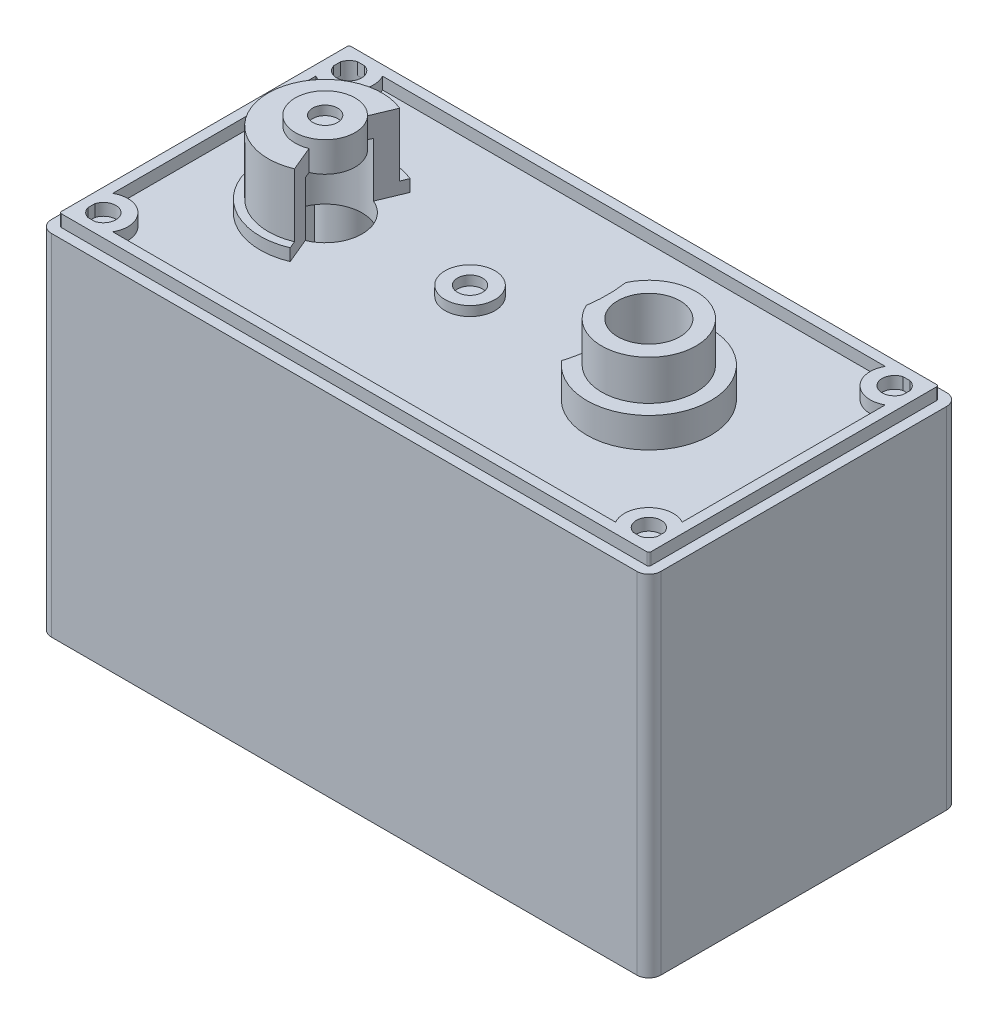
from build123d import *

# Parameters (mm, degrees)
SKETCH1_R                       = 2.3495
SKETCH1_R_2                     = 1.9812
EXTRUDE1_DEPTH                  = 1.190625
SKETCH6_R                       = 1.5875
SKETCH6_R_2                     = 0.79375
EXTRUDE3_DEPTH                  = 0.6096
SKETCH7_R                       = 3
SKETCH7_R_2                     = 1.9812
EXTRUDE4_DEPTH                  = 4.445
SKETCH16_R                      = 3.937
SKETCH16_R_2                    = 3
EXTRUDE11_DEPTH                 = 1.905
CUT_EXTRUDE1_REACH              = 24.444
SKETCH11_R                      = 7.874
SKETCH11_R_2                    = 6.604
EXTRUDE6_DEPTH                  = 4.572
EXTRUDE5_START                  = 22.225
SKETCH10_W                      = 37.211
SKETCH10_H                      = 18.161
EXTRUDE5_DEPTH                  = 22.225
SKETCH13_W                      = 1.143
SKETCH13_H                      = 3.048
EXTRUDE8_DEPTH                  = 10.795
EXTRUDE9_START                  = -1.952625
SKETCH14_R                      = 0.79375
EXTRUDE9_DEPTH                  = 22.987
SKETCH23_R                      = 0.79375
CUT_EXTRUDE2_DEPTH              = 1.190625
CUT_EXTRUDE3_REACH              = 36.655
MIRROR2_START                   = -1.952625
MIRROR2_COPY_1_SKETCH_R         = 0.79375
MIRROR2_COPY_1_DEPTH            = 22.987
SKETCH18_W                      = 36.195
SKETCH18_H                      = 17.145
EXTRUDE12_DEPTH                 = 0.762
SKETCH19_R                      = 2.54
EXTRUDE13_DEPTH                 = 1.905
EXTRUDE14_DEPTH                 = 5.588
F_1_64_TAPPED_HOLE1_D           = 1.5113
F_1_64_TAPPED_HOLE1_DEPTH       = 5.588
F_1_64_TAPPED_HOLE1_CBORE_D     = 1.8542
F_1_64_TAPPED_HOLE1_CBORE_DEPTH = 3.7084


with BuildPart() as part:
    # Sketch1 → Extrude1 (new body)
    with BuildSketch(Plane(origin=(0, 0, 0), x_dir=(1, 0, 0), z_dir=(0, 1, 0))):
        with BuildLine():
            Line((-18.6055, 9.8425), (18.6055, 9.8425))
            ThreePointArc((18.6055, 9.8425), (19.144315367, 9.619315367), (19.3675, 9.0805))
            Line((19.3675, 9.0805), (19.3675, -9.0805))
            ThreePointArc((19.3675, -9.0805), (19.144315367, -9.619315367), (18.6055, -9.8425))
            Line((18.6055, -9.8425), (-18.6055, -9.8425))
            ThreePointArc((-18.6055, -9.8425), (-19.144315367, -9.619315367), (-19.3675, -9.0805))
            Line((-19.3675, -9.0805), (-19.3675, 9.0805))
            ThreePointArc((-19.3675, 9.0805), (-19.144315367, 9.619315367), (-18.6055, 9.8425))
        make_face()
        with Locations(Location((-11.049, 0, 0), (0, 0, 90))):
            Circle(SKETCH1_R, mode=Mode.SUBTRACT)
        with Locations(Location((9.525, 0, 0), (0, 0, 90))):
            Circle(SKETCH1_R_2, mode=Mode.SUBTRACT)
    extrude(amount=EXTRUDE1_DEPTH)

    # Sketch6 → Extrude3 (add)
    with BuildSketch(Plane(origin=(0, 1.190625, 0), x_dir=(-1, 0, 0), z_dir=(0, 1, 0))):
        with Locations(Location((1.8415, 0, 0), (0, 0, 270))):
            Circle(SKETCH6_R)
        with Locations(Location((1.8415, 0, 0), (0, 0, 90))):
            Circle(SKETCH6_R_2, mode=Mode.SUBTRACT)
    extrude(amount=EXTRUDE3_DEPTH)

    # Sketch7 → Extrude4 (add)
    with BuildSketch(Plane(origin=(0, 1.190625, 0), x_dir=(-1, 0, 0), z_dir=(0, 1, 0))):
        with Locations(Location((-9.525, 0, 0), (0, 0, 270))):
            Circle(SKETCH7_R)
        with Locations(Location((-9.525, 0, 0), (0, 0, 270))):
            Circle(SKETCH7_R_2, mode=Mode.SUBTRACT)
    extrude(amount=EXTRUDE4_DEPTH)

    # Sketch16 → Extrude11 (add)
    with BuildSketch(Plane(origin=(0, 1.190625, 0), x_dir=(-1, 0, 0), z_dir=(0, 1, 0))):
        with Locations(Location((-9.525, 0, 0), (0, 0, 270))):
            Circle(SKETCH16_R)
        with Locations(Location((-9.525, 0, 0), (0, 0, 90))):
            Circle(SKETCH16_R_2, mode=Mode.SUBTRACT)
    extrude(amount=EXTRUDE11_DEPTH)

    # Cut-Extrude1: up to this face of the body (flat: up to its plane)
    cut_extrude1_end = Plane(part.part.faces().sort_by_distance((0, 1.190625, -9.408000351))[0])
    # Sketch17 → Cut-Extrude1 (cut, up to the picked face)
    with BuildSketch(Plane(origin=(0, 5.635625, 0), x_dir=(-1, 0, 0), z_dir=(0, 1, 0)), mode=Mode.PRIVATE) as cut_extrude1_sk1:
        with BuildLine():
            ThreePointArc((-6.516949302, 2.54), (-6.894361419, 0), (-6.516949302, -2.54))
            ThreePointArc((-6.516949302, -2.54), (-5.588, 0), (-6.516949302, 2.54))
        make_face()
    cut_extrude1_tool1 = split(extrude(cut_extrude1_sk1.sketch, amount=-CUT_EXTRUDE1_REACH, mode=Mode.PRIVATE), bisect_by=cut_extrude1_end, keep=Keep.BOTH, mode=Mode.PRIVATE)
    add(cut_extrude1_tool1.solids().sort_by(Axis((6.291228, 5.635625, 0), (0, -1, 0)))[0], mode=Mode.SUBTRACT)

    # Sketch11 → Extrude6 (add)
    with BuildSketch(Plane.XZ):
        with Locations(Location((9.525, 0, 0), (0, 0, 270))):
            Circle(SKETCH11_R)
        with Locations(Location((9.525, 0, 0), (0, 0, 270))):
            Circle(SKETCH11_R_2, mode=Mode.SUBTRACT)
    extrude(amount=EXTRUDE6_DEPTH)

    # Sketch10 → Extrude5 (add)
    with BuildSketch(Plane.XZ.offset(-1.190625).offset(EXTRUDE5_START)):
        with BuildLine():
            Line((-19.3675, 9.0805), (-19.3675, -9.0805))
            ThreePointArc((-19.3675, -9.0805), (-19.144315367, -9.619315367), (-18.6055, -9.8425))
            Line((-18.6055, -9.8425), (18.6055, -9.8425))
            ThreePointArc((18.6055, -9.8425), (19.144315367, -9.619315367), (19.3675, -9.0805))
            Line((19.3675, -9.0805), (19.3675, 9.0805))
            ThreePointArc((19.3675, 9.0805), (19.144315367, 9.619315367), (18.6055, 9.8425))
            Line((18.6055, 9.8425), (-18.6055, 9.8425))
            ThreePointArc((-18.6055, 9.8425), (-19.144315367, 9.619315367), (-19.3675, 9.0805))
        make_face()
        Rectangle(SKETCH10_W, SKETCH10_H, mode=Mode.SUBTRACT)
    extrude(amount=-EXTRUDE5_DEPTH)

    # Sketch13 → Extrude8 (add)
    with BuildSketch(Plane.XZ):
        with BuildLine():
            Line((-5.9055, 6.0325), (-5.9055, 9.0805))
            Line((-5.9055, 9.0805), (-4.7625, 9.0805))
            Line((-4.7625, 9.0805), (-4.7625, 6.713831938))
            ThreePointArc((-4.7625, 6.713831938), (-1.851412189, 0), (-4.7625, -6.713831938))
            Line((-4.7625, -6.713831938), (-4.7625, -9.0805))
            Line((-4.7625, -9.0805), (-5.9055, -9.0805))
            Line((-5.9055, -9.0805), (-5.9055, -6.0325))
            ThreePointArc((-5.9055, -6.0325), (-3.121412189, 0), (-5.9055, 6.0325))
        make_face()
        with Locations((-8.382, 7.5565)):
            Rectangle(SKETCH13_W, SKETCH13_H)
        with Locations((-13.335, 7.5565)):
            Rectangle(SKETCH13_W, SKETCH13_H)
        with Locations((-13.335, -7.5565)):
            Rectangle(SKETCH13_W, SKETCH13_H)
        with Locations((-8.382, -7.5565)):
            Rectangle(SKETCH13_W, SKETCH13_H)
    extrude(amount=EXTRUDE8_DEPTH)

    # Sketch14 → Extrude9 (add)
    with BuildSketch(Plane.XZ.offset(EXTRUDE9_START)):
        with BuildLine():
            Line((-18.6055, -9.0805), (-18.6055, -6.911913297))
            ThreePointArc((-18.6055, -6.911913297), (-16.235418625, -6.710418625), (-16.436913297, -9.0805))
            Line((-16.436913297, -9.0805), (-18.6055, -9.0805))
        make_face()
        with Locations(Location((-17.3355, -7.8105, 0), (0, 0, 270))):
            Circle(SKETCH14_R, mode=Mode.SUBTRACT)
    extrude9 = extrude(amount=EXTRUDE9_DEPTH)

    # Sketch23 → Cut-Extrude2 (cut)
    with BuildSketch(Plane(origin=(0, 1.190625, 0), x_dir=(-1, 0, 0), z_dir=(0, 1, 0))):
        with Locations(Location((17.3355, -7.8105, 0), (0, 0, 270))):
            Circle(SKETCH23_R)
    extrude(amount=-CUT_EXTRUDE2_DEPTH, mode=Mode.SUBTRACT)

    # Sketch9 → Revolve1 (revolve)
    with BuildSketch(Plane.XY, mode=Mode.PRIVATE) as revolve1_sk:
        Polygon((-12.954, 5.965825), (-12.954, 6.550025), (-11.84275, 6.550025), (-11.84275, 5.965825), (-11.049, 5.965825), (-11.049, 4.645025), (-13.3985, 4.645025), (-13.3985, 1.190625), (-15.1765, 1.190625), (-15.1765, 1.952625), (-14.6685, 1.952625), (-14.6685, 5.965825), align=None)
    revolve(revolve1_sk.sketch.rotate(Axis((-11.049, 0, 0), (0, 1, 0)), 270), axis=Axis((-11.049, 0, 0), (0, 1, 0)))

    # Cut-Extrude3: up to this face of the body (flat: up to its plane)
    cut_extrude3_end = Plane(part.part.faces().sort_by_distance((-1.8415, 1.190625, 0))[0])
    # Sketch24 → Cut-Extrude3 (cut, up to the picked face)
    with BuildSketch(Plane(origin=(0, 5.965825, 0), x_dir=(-1, 0, 0), z_dir=(0, 1, 0)), mode=Mode.PRIVATE) as cut_extrude3_sk1:
        with BuildLine():
            Line((10.316307692, 1.758461538), (9.4615, 3.81))
            ThreePointArc((9.4615, 3.81), (6.9215, 0), (9.4615, -3.81))
            Line((9.4615, -3.81), (10.316307692, -1.758461538))
            ThreePointArc((10.316307692, -1.758461538), (9.144, 0), (10.316307692, 1.758461538))
        make_face()
    cut_extrude3_tool1 = split(extrude(cut_extrude3_sk1.sketch, amount=-CUT_EXTRUDE3_REACH, mode=Mode.PRIVATE), bisect_by=cut_extrude3_end, keep=Keep.BOTH, mode=Mode.PRIVATE)
    add(cut_extrude3_tool1.solids().sort_by(Axis((-8.574349, 5.965825, 0), (0, -1, 0)))[0], mode=Mode.SUBTRACT)

    # Mirror1: Extrude9 across plane
    add(extrude9.mirror(Plane(origin=(0, 0, 0), x_dir=(0, 0, 1), z_dir=(1, 0, 0))))

    # Mirror2: Extrude9 across plane
    add(extrude9.mirror(Plane.XY))

    # Mirror2 copy 1 sketch → Mirror2 copy 1 (add)
    with BuildSketch(Plane(origin=(0, 0, 0), x_dir=(-1, 0, 0), z_dir=(0, -1, 0)).offset(MIRROR2_START)):
        with BuildLine():
            Line((-18.6055, -9.0805), (-18.6055, -6.911913297))
            ThreePointArc((-18.6055, -6.911913297), (-16.235418625, -6.710418625), (-16.436913297, -9.0805))
            Line((-16.436913297, -9.0805), (-18.6055, -9.0805))
        make_face()
        with Locations(Location((-17.3355, -7.8105, 0), (0, 0, 270))):
            Circle(MIRROR2_COPY_1_SKETCH_R, mode=Mode.SUBTRACT)
    extrude(amount=MIRROR2_COPY_1_DEPTH)

    # Sketch18 → Extrude12 (add)
    with BuildSketch(Plane(origin=(0, 1.952625, 0), x_dir=(-1, 0, 0), z_dir=(0, 1, 0))):
        with BuildLine():
            Line((18.6055, 9.2075), (-18.6055, 9.2075))
            ThreePointArc((-18.6055, 9.2075), (-18.695302561, 9.170302561), (-18.7325, 9.0805))
            Line((-18.7325, 9.0805), (-18.7325, -9.0805))
            ThreePointArc((-18.7325, -9.0805), (-18.695302561, -9.170302561), (-18.6055, -9.2075))
            Line((-18.6055, -9.2075), (18.6055, -9.2075))
            ThreePointArc((18.6055, -9.2075), (18.695302561, -9.170302561), (18.7325, -9.0805))
            Line((18.7325, -9.0805), (18.7325, 9.0805))
            ThreePointArc((18.7325, 9.0805), (18.695302561, 9.170302561), (18.6055, 9.2075))
        make_face()
        Rectangle(SKETCH18_W, SKETCH18_H, mode=Mode.SUBTRACT)
    extrude(amount=-EXTRUDE12_DEPTH)

    # Sketch19 → Extrude13 (add)
    with BuildSketch(Plane.XZ):
        with BuildLine():
            Line((11.557, -3.222898695), (11.557, -6.283612973))
            ThreePointArc((11.557, -6.283612973), (11.178939296, -6.393535861), (10.795, -6.480734218))
            Line((10.795, -6.480734218), (10.795, -3.592102448))
            ThreePointArc((10.795, -3.592102448), (9.525, -3.81), (8.255, -3.592102448))
            Line((8.255, -3.592102448), (8.255, -6.480734218))
            ThreePointArc((8.255, -6.480734218), (7.871060704, -6.393535861), (7.493, -6.283612973))
            Line((7.493, -6.283612973), (7.493, -3.222898695))
            ThreePointArc((7.493, -3.222898695), (9.525, 3.81), (11.557, -3.222898695))
        make_face()
        with Locations(Location((9.525, 0, 0), (0, 0, 90))):
            Circle(SKETCH19_R, mode=Mode.SUBTRACT)
    extrude(amount=EXTRUDE13_DEPTH)

    # Sketch20 → Extrude14 (add)
    with BuildSketch(Plane.XZ):
        with BuildLine():
            ThreePointArc((4.320531036, -4.065257532), (3.147336001, -7.413112903), (6.282470752, -5.753157401))
            ThreePointArc((6.282470752, -5.753157401), (5.218006131, -5.006258065), (4.320531036, -4.065257532))
        make_face()
    extrude(amount=EXTRUDE14_DEPTH)

    # #1-64 Tapped Hole1
    with Locations(Plane(origin=(4.389738079, -5.588, -5.969), x_dir=(0, 0, -1), z_dir=(0, -1, 0))):
        with Locations((0, 0)):
            CounterBoreHole(F_1_64_TAPPED_HOLE1_D / 2, F_1_64_TAPPED_HOLE1_CBORE_D / 2, F_1_64_TAPPED_HOLE1_CBORE_DEPTH, depth=F_1_64_TAPPED_HOLE1_DEPTH)


solid = part.part
